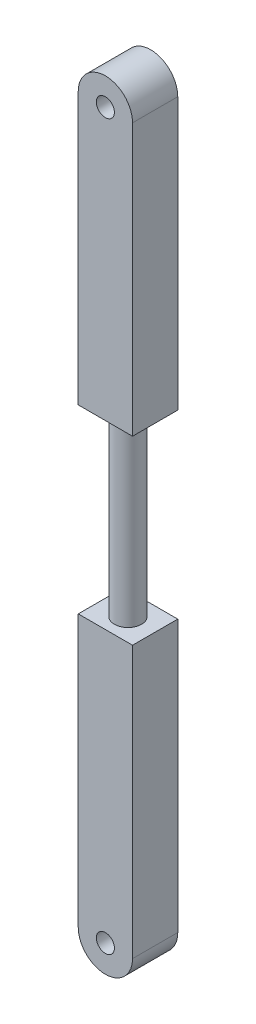
from build123d import *

# Parameters (mm, degrees)
SKETCH_1_R          = 1
EXTRUDE_1_DEPTH     = 2.5
SKETCH_4_R          = 5.341815289
SKETCH_4_R_2        = 1.5
CUT_EXTRUDE_2_DEPTH = 10


with BuildPart() as part:
    # 草图1 → 凸台-拉伸1 (new, symmetric)
    with BuildSketch(Plane.XY):
        with BuildLine():
            Line((3, 0), (3, -80))
            ThreePointArc((3, -80), (0, -83), (-3, -80))
            Line((-3, -80), (-3, 0))
            ThreePointArc((-3, 0), (0, 3), (3, 0))
        make_face()
        Circle(SKETCH_1_R, mode=Mode.SUBTRACT)
        with Locations((0, -80)):
            Circle(SKETCH_1_R, mode=Mode.SUBTRACT)
    extrude(amount=EXTRUDE_1_DEPTH, both=True)


with BuildPart() as part_1:
    # Move Body 1: moved
    add(part.part.moved(Location((0, 40, 0))))

    # 草图4 → 切除-拉伸2 (cut, symmetric)
    with BuildSketch(Plane(origin=(0, 0, 0), x_dir=(1, 0, 0), z_dir=(0, 1, 0))):
        Circle(SKETCH_4_R)
        with Locations(Location((0, 0, 0), (0, 0, 270))):
            Circle(SKETCH_4_R_2, mode=Mode.SUBTRACT)
    extrude(amount=CUT_EXTRUDE_2_DEPTH, both=True, mode=Mode.SUBTRACT)


solid = part_1.part
